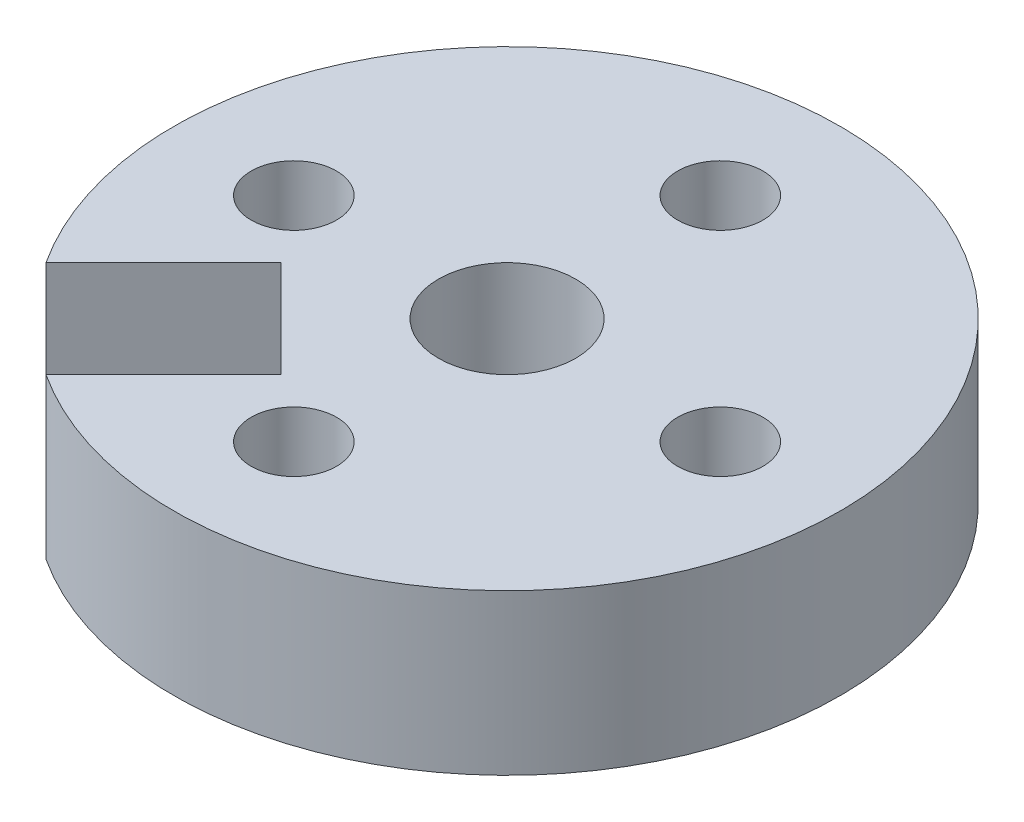
from build123d import *

# Parameters (mm, degrees)
SKETCH_1_R          = 12.5
EXTRUDE_1_DEPTH     = 6
SKETCH_4_R          = 1.6
CUT_EXTRUDE_2_DEPTH = 30
CUT_EXTRUDE_3_DEPTH = 30
SKETCH_6_R          = 1.6
CUT_EXTRUDE_4_DEPTH = 6


with BuildPart() as part:
    # 草图1 → 凸台-拉伸1 (new body)
    with BuildSketch(Plane(origin=(0, 0, 0), x_dir=(1, 0, 0), z_dir=(0, 1, 0))):
        with Locations(Location((0, 0, 0), (0, 0, 270))):
            Circle(SKETCH_1_R)
    extrude(amount=EXTRUDE_1_DEPTH)

    # 草图4 → 切除-拉伸2 (cut)
    with BuildSketch(Plane(origin=(0, 0, 0), x_dir=(1, 0, 0), z_dir=(0, 1, 0))):
        with Locations(Location((0, 8, 0), (0, 0, 270))):
            Circle(SKETCH_4_R)
        with Locations(Location((8, 0, 0), (0, 0, 270))):
            Circle(SKETCH_4_R)
        with Locations(Location((0, -8, 0), (0, 0, 270))):
            Circle(SKETCH_4_R)
        with Locations(Location((-8, 0, 0), (0, 0, 270))):
            Circle(SKETCH_4_R)
    extrude(amount=CUT_EXTRUDE_2_DEPTH, mode=Mode.SUBTRACT)

    # 草图5 → 切除-拉伸3 (cut)
    with BuildSketch(Plane.XZ):
        with BuildLine():
            Line((-4.242640687, 4.242640687), (-8.838834765, 8.838834765))
            ThreePointArc((-8.838834765, 8.838834765), (-9.706634329, 7.875992001), (-10.470059323, 6.8284594))
            Line((-10.470059323, 6.8284594), (-6.063440649, 2.421840726))
            Line((-6.063440649, 2.421840726), (-4.242640687, 4.242640687))
        make_face()
        with BuildLine():
            ThreePointArc((-6.8284594, 10.470059323), (-7.875992001, 9.706634329), (-8.838834765, 8.838834765))
            Line((-8.838834765, 8.838834765), (-4.242640687, 4.242640687))
            Line((-4.242640687, 4.242640687), (-2.421840726, 6.063440649))
            Line((-2.421840726, 6.063440649), (-6.8284594, 10.470059323))
        make_face()
        with BuildLine():
            ThreePointArc((0, 2.575), (-0.985409838, 2.378989796), (-1.820799962, 1.820799962))
            Line((-1.820799962, 1.820799962), (0, 0))
            Line((0, 0), (0, 2.575))
        make_face()
        with BuildLine():
            Line((0, 0), (-1.820799962, 1.820799962))
            ThreePointArc((-1.820799962, 1.820799962), (-0.985409838, -2.378989796), (2.575, 0))
            ThreePointArc((2.575, 0), (1.820799962, 1.820799962), (0, 2.575))
            Line((0, 2.575), (0, 0))
        make_face()
    extrude(amount=-CUT_EXTRUDE_3_DEPTH, mode=Mode.SUBTRACT)

    # 草图6 → 切除-拉伸4 (cut)
    with BuildSketch(Plane(origin=(-4.242640687, 0, 4.242640687), x_dir=(0.7071067811865509, 0, 0.7071067811865442), z_dir=(-0.7071067811865442, 0, 0.7071067811865509))):
        with Locations((0, 3)):
            Circle(SKETCH_6_R)
    extrude(amount=-CUT_EXTRUDE_4_DEPTH, mode=Mode.SUBTRACT)


solid = part.part
